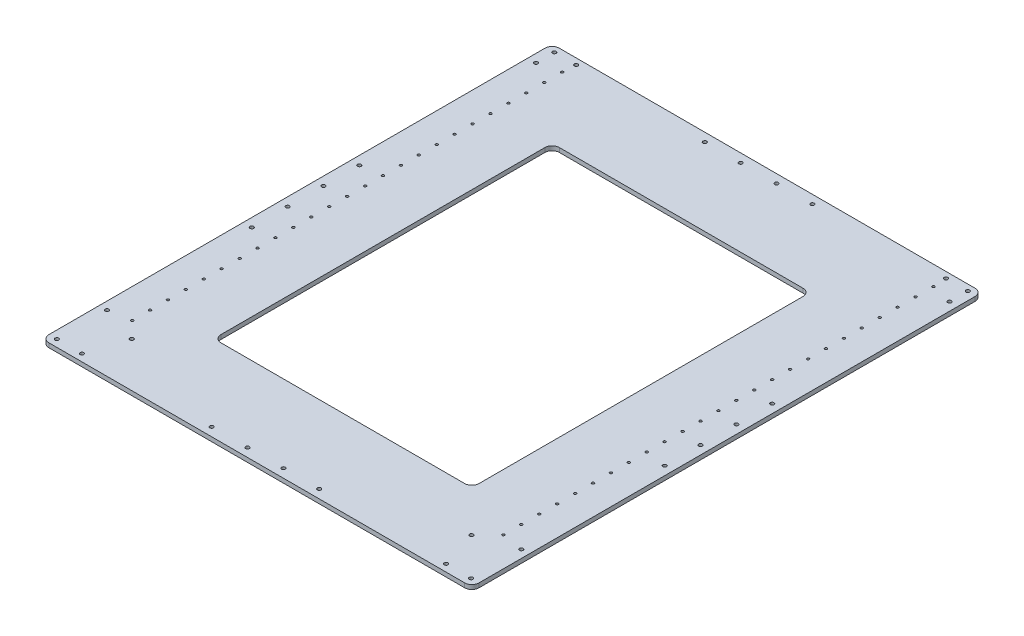
from build123d import *

# Parameters (mm, degrees)
SKETCH1_W                = 600
SKETCH1_H                = 730
BOSS_EXTRUDE1_DEPTH      = 6
SKETCH2_R                = 1.75
CUT_EXTRUDE1_DEPTH       = 473.505026428
LPATTERN1_COUNT          = 25
LPATTERN1_PITCH          = 25
MIRROR2_COPY_1_SKETCH_R  = 1.75
MIRROR2_COPY_1_DEPTH     = 473.505026428
MIRROR2_COPY_2_SKETCH_R  = 1.75
MIRROR2_COPY_2_DEPTH     = 473.505026428
MIRROR2_COPY_3_SKETCH_R  = 1.75
MIRROR2_COPY_3_DEPTH     = 473.505026428
MIRROR2_COPY_4_SKETCH_R  = 1.75
MIRROR2_COPY_4_DEPTH     = 473.505026428
MIRROR2_COPY_5_SKETCH_R  = 1.75
MIRROR2_COPY_5_DEPTH     = 473.505026428
MIRROR2_COPY_6_SKETCH_R  = 1.75
MIRROR2_COPY_6_DEPTH     = 473.505026428
MIRROR2_COPY_7_SKETCH_R  = 1.75
MIRROR2_COPY_7_DEPTH     = 473.505026428
MIRROR2_COPY_8_SKETCH_R  = 1.75
MIRROR2_COPY_8_DEPTH     = 473.505026428
MIRROR2_COPY_9_SKETCH_R  = 1.75
MIRROR2_COPY_9_DEPTH     = 473.505026428
MIRROR2_COPY_10_SKETCH_R = 1.75
MIRROR2_COPY_10_DEPTH    = 473.505026428
MIRROR2_COPY_11_SKETCH_R = 1.75
MIRROR2_COPY_11_DEPTH    = 473.505026428
MIRROR2_COPY_12_SKETCH_R = 1.75
MIRROR2_COPY_12_DEPTH    = 473.505026428
MIRROR2_COPY_13_SKETCH_R = 1.75
MIRROR2_COPY_13_DEPTH    = 473.505026428
MIRROR2_COPY_14_SKETCH_R = 1.75
MIRROR2_COPY_14_DEPTH    = 473.505026428
MIRROR2_COPY_15_SKETCH_R = 1.75
MIRROR2_COPY_15_DEPTH    = 473.505026428
MIRROR2_COPY_16_SKETCH_R = 1.75
MIRROR2_COPY_16_DEPTH    = 473.505026428
MIRROR2_COPY_17_SKETCH_R = 1.75
MIRROR2_COPY_17_DEPTH    = 473.505026428
MIRROR2_COPY_18_SKETCH_R = 1.75
MIRROR2_COPY_18_DEPTH    = 473.505026428
MIRROR2_COPY_19_SKETCH_R = 1.75
MIRROR2_COPY_19_DEPTH    = 473.505026428
MIRROR2_COPY_20_SKETCH_R = 1.75
MIRROR2_COPY_20_DEPTH    = 473.505026428
MIRROR2_COPY_21_SKETCH_R = 1.75
MIRROR2_COPY_21_DEPTH    = 473.505026428
MIRROR2_COPY_22_SKETCH_R = 1.75
MIRROR2_COPY_22_DEPTH    = 473.505026428
MIRROR2_COPY_23_SKETCH_R = 1.75
MIRROR2_COPY_23_DEPTH    = 473.505026428
MIRROR2_COPY_24_SKETCH_R = 1.75
MIRROR2_COPY_24_DEPTH    = 473.505026428
SKETCH3_R                = 2.55
CUT_EXTRUDE2_DEPTH       = 13
SKETCH5_R                = 2.55
CUT_EXTRUDE4_DEPTH       = 473.505026428
SKETCH6_W                = 600
SKETCH6_H                = 18
CUT_EXTRUDE5_DEPTH       = 6
CUT_EXTRUDE6_REACH       = 474.505
SKETCH7_R                = 2.55
CUT_EXTRUDE7_REACH       = 474.505
SKETCH8_R                = 2.55
CUT_EXTRUDE8_REACH       = 474.505
SKETCH9_W                = 360
SKETCH9_H                = 472
FILLET2_R                = 10


with BuildPart() as part:
    # Sketch1 → Boss-Extrude1 (new body)
    with BuildSketch(Plane(origin=(0, 0, 0), x_dir=(1, 0, 0), z_dir=(0, 1, 0))):
        Rectangle(SKETCH1_W, SKETCH1_H)
    extrude(amount=BOSS_EXTRUDE1_DEPTH)

    # Sketch2 → Cut-Extrude1 (cut, through all)
    with BuildSketch(Plane(origin=(0, 6, 0), x_dir=(1, 0, 0), z_dir=(0, 1, 0))):
        with Locations(Location((-259, 320, 0), (0, 0, 270))):
            Circle(SKETCH2_R)
    cut_extrude1 = extrude(amount=-CUT_EXTRUDE1_DEPTH, mode=Mode.SUBTRACT)

    # LPattern1: Cut-Extrude1 ×25
    with Locations(*[(0, 0, i * LPATTERN1_PITCH) for i in range(1, LPATTERN1_COUNT)]):
        add(cut_extrude1, mode=Mode.SUBTRACT)

    # Mirror2: Cut-Extrude1 across plane
    add(cut_extrude1.mirror(Plane(origin=(0, 0, 0), x_dir=(0, 0, 1), z_dir=(1, 0, 0))), mode=Mode.SUBTRACT)

    # Mirror2 copy 1 sketch → Mirror2 copy 1 (cut, through all)
    with BuildSketch(Plane(origin=(0, 6, 25), x_dir=(-1, 0, 0), z_dir=(0, 1, 0))):
        with Locations((-259, -320)):
            Circle(MIRROR2_COPY_1_SKETCH_R)
    extrude(amount=-MIRROR2_COPY_1_DEPTH, mode=Mode.SUBTRACT)

    # Mirror2 copy 2 sketch → Mirror2 copy 2 (cut, through all)
    with BuildSketch(Plane(origin=(0, 6, 50), x_dir=(-1, 0, 0), z_dir=(0, 1, 0))):
        with Locations((-259, -320)):
            Circle(MIRROR2_COPY_2_SKETCH_R)
    extrude(amount=-MIRROR2_COPY_2_DEPTH, mode=Mode.SUBTRACT)

    # Mirror2 copy 3 sketch → Mirror2 copy 3 (cut, through all)
    with BuildSketch(Plane(origin=(0, 6, 75), x_dir=(-1, 0, 0), z_dir=(0, 1, 0))):
        with Locations((-259, -320)):
            Circle(MIRROR2_COPY_3_SKETCH_R)
    extrude(amount=-MIRROR2_COPY_3_DEPTH, mode=Mode.SUBTRACT)

    # Mirror2 copy 4 sketch → Mirror2 copy 4 (cut, through all)
    with BuildSketch(Plane(origin=(0, 6, 100), x_dir=(-1, 0, 0), z_dir=(0, 1, 0))):
        with Locations((-259, -320)):
            Circle(MIRROR2_COPY_4_SKETCH_R)
    extrude(amount=-MIRROR2_COPY_4_DEPTH, mode=Mode.SUBTRACT)

    # Mirror2 copy 5 sketch → Mirror2 copy 5 (cut, through all)
    with BuildSketch(Plane(origin=(0, 6, 125), x_dir=(-1, 0, 0), z_dir=(0, 1, 0))):
        with Locations((-259, -320)):
            Circle(MIRROR2_COPY_5_SKETCH_R)
    extrude(amount=-MIRROR2_COPY_5_DEPTH, mode=Mode.SUBTRACT)

    # Mirror2 copy 6 sketch → Mirror2 copy 6 (cut, through all)
    with BuildSketch(Plane(origin=(0, 6, 150), x_dir=(-1, 0, 0), z_dir=(0, 1, 0))):
        with Locations((-259, -320)):
            Circle(MIRROR2_COPY_6_SKETCH_R)
    extrude(amount=-MIRROR2_COPY_6_DEPTH, mode=Mode.SUBTRACT)

    # Mirror2 copy 7 sketch → Mirror2 copy 7 (cut, through all)
    with BuildSketch(Plane(origin=(0, 6, 175), x_dir=(-1, 0, 0), z_dir=(0, 1, 0))):
        with Locations((-259, -320)):
            Circle(MIRROR2_COPY_7_SKETCH_R)
    extrude(amount=-MIRROR2_COPY_7_DEPTH, mode=Mode.SUBTRACT)

    # Mirror2 copy 8 sketch → Mirror2 copy 8 (cut, through all)
    with BuildSketch(Plane(origin=(0, 6, 200), x_dir=(-1, 0, 0), z_dir=(0, 1, 0))):
        with Locations((-259, -320)):
            Circle(MIRROR2_COPY_8_SKETCH_R)
    extrude(amount=-MIRROR2_COPY_8_DEPTH, mode=Mode.SUBTRACT)

    # Mirror2 copy 9 sketch → Mirror2 copy 9 (cut, through all)
    with BuildSketch(Plane(origin=(0, 6, 225), x_dir=(-1, 0, 0), z_dir=(0, 1, 0))):
        with Locations((-259, -320)):
            Circle(MIRROR2_COPY_9_SKETCH_R)
    extrude(amount=-MIRROR2_COPY_9_DEPTH, mode=Mode.SUBTRACT)

    # Mirror2 copy 10 sketch → Mirror2 copy 10 (cut, through all)
    with BuildSketch(Plane(origin=(0, 6, 250), x_dir=(-1, 0, 0), z_dir=(0, 1, 0))):
        with Locations((-259, -320)):
            Circle(MIRROR2_COPY_10_SKETCH_R)
    extrude(amount=-MIRROR2_COPY_10_DEPTH, mode=Mode.SUBTRACT)

    # Mirror2 copy 11 sketch → Mirror2 copy 11 (cut, through all)
    with BuildSketch(Plane(origin=(0, 6, 275), x_dir=(-1, 0, 0), z_dir=(0, 1, 0))):
        with Locations((-259, -320)):
            Circle(MIRROR2_COPY_11_SKETCH_R)
    extrude(amount=-MIRROR2_COPY_11_DEPTH, mode=Mode.SUBTRACT)

    # Mirror2 copy 12 sketch → Mirror2 copy 12 (cut, through all)
    with BuildSketch(Plane(origin=(0, 6, 300), x_dir=(-1, 0, 0), z_dir=(0, 1, 0))):
        with Locations((-259, -320)):
            Circle(MIRROR2_COPY_12_SKETCH_R)
    extrude(amount=-MIRROR2_COPY_12_DEPTH, mode=Mode.SUBTRACT)

    # Mirror2 copy 13 sketch → Mirror2 copy 13 (cut, through all)
    with BuildSketch(Plane(origin=(0, 6, 325), x_dir=(-1, 0, 0), z_dir=(0, 1, 0))):
        with Locations((-259, -320)):
            Circle(MIRROR2_COPY_13_SKETCH_R)
    extrude(amount=-MIRROR2_COPY_13_DEPTH, mode=Mode.SUBTRACT)

    # Mirror2 copy 14 sketch → Mirror2 copy 14 (cut, through all)
    with BuildSketch(Plane(origin=(0, 6, 350), x_dir=(-1, 0, 0), z_dir=(0, 1, 0))):
        with Locations((-259, -320)):
            Circle(MIRROR2_COPY_14_SKETCH_R)
    extrude(amount=-MIRROR2_COPY_14_DEPTH, mode=Mode.SUBTRACT)

    # Mirror2 copy 15 sketch → Mirror2 copy 15 (cut, through all)
    with BuildSketch(Plane(origin=(0, 6, 375), x_dir=(-1, 0, 0), z_dir=(0, 1, 0))):
        with Locations((-259, -320)):
            Circle(MIRROR2_COPY_15_SKETCH_R)
    extrude(amount=-MIRROR2_COPY_15_DEPTH, mode=Mode.SUBTRACT)

    # Mirror2 copy 16 sketch → Mirror2 copy 16 (cut, through all)
    with BuildSketch(Plane(origin=(0, 6, 400), x_dir=(-1, 0, 0), z_dir=(0, 1, 0))):
        with Locations((-259, -320)):
            Circle(MIRROR2_COPY_16_SKETCH_R)
    extrude(amount=-MIRROR2_COPY_16_DEPTH, mode=Mode.SUBTRACT)

    # Mirror2 copy 17 sketch → Mirror2 copy 17 (cut, through all)
    with BuildSketch(Plane(origin=(0, 6, 425), x_dir=(-1, 0, 0), z_dir=(0, 1, 0))):
        with Locations((-259, -320)):
            Circle(MIRROR2_COPY_17_SKETCH_R)
    extrude(amount=-MIRROR2_COPY_17_DEPTH, mode=Mode.SUBTRACT)

    # Mirror2 copy 18 sketch → Mirror2 copy 18 (cut, through all)
    with BuildSketch(Plane(origin=(0, 6, 450), x_dir=(-1, 0, 0), z_dir=(0, 1, 0))):
        with Locations((-259, -320)):
            Circle(MIRROR2_COPY_18_SKETCH_R)
    extrude(amount=-MIRROR2_COPY_18_DEPTH, mode=Mode.SUBTRACT)

    # Mirror2 copy 19 sketch → Mirror2 copy 19 (cut, through all)
    with BuildSketch(Plane(origin=(0, 6, 475), x_dir=(-1, 0, 0), z_dir=(0, 1, 0))):
        with Locations((-259, -320)):
            Circle(MIRROR2_COPY_19_SKETCH_R)
    extrude(amount=-MIRROR2_COPY_19_DEPTH, mode=Mode.SUBTRACT)

    # Mirror2 copy 20 sketch → Mirror2 copy 20 (cut, through all)
    with BuildSketch(Plane(origin=(0, 6, 500), x_dir=(-1, 0, 0), z_dir=(0, 1, 0))):
        with Locations((-259, -320)):
            Circle(MIRROR2_COPY_20_SKETCH_R)
    extrude(amount=-MIRROR2_COPY_20_DEPTH, mode=Mode.SUBTRACT)

    # Mirror2 copy 21 sketch → Mirror2 copy 21 (cut, through all)
    with BuildSketch(Plane(origin=(0, 6, 525), x_dir=(-1, 0, 0), z_dir=(0, 1, 0))):
        with Locations((-259, -320)):
            Circle(MIRROR2_COPY_21_SKETCH_R)
    extrude(amount=-MIRROR2_COPY_21_DEPTH, mode=Mode.SUBTRACT)

    # Mirror2 copy 22 sketch → Mirror2 copy 22 (cut, through all)
    with BuildSketch(Plane(origin=(0, 6, 550), x_dir=(-1, 0, 0), z_dir=(0, 1, 0))):
        with Locations((-259, -320)):
            Circle(MIRROR2_COPY_22_SKETCH_R)
    extrude(amount=-MIRROR2_COPY_22_DEPTH, mode=Mode.SUBTRACT)

    # Mirror2 copy 23 sketch → Mirror2 copy 23 (cut, through all)
    with BuildSketch(Plane(origin=(0, 6, 575), x_dir=(-1, 0, 0), z_dir=(0, 1, 0))):
        with Locations((-259, -320)):
            Circle(MIRROR2_COPY_23_SKETCH_R)
    extrude(amount=-MIRROR2_COPY_23_DEPTH, mode=Mode.SUBTRACT)

    # Mirror2 copy 24 sketch → Mirror2 copy 24 (cut, through all)
    with BuildSketch(Plane(origin=(0, 6, 600), x_dir=(-1, 0, 0), z_dir=(0, 1, 0))):
        with Locations((-259, -320)):
            Circle(MIRROR2_COPY_24_SKETCH_R)
    extrude(amount=-MIRROR2_COPY_24_DEPTH, mode=Mode.SUBTRACT)

    # Sketch3 → Cut-Extrude2 (cut)
    with BuildSketch(Plane(origin=(0, 6, 0), x_dir=(1, 0, 0), z_dir=(0, 1, 0))):
        with Locations(Location((-289, -285, 0), (0, 0, 270))):
            Circle(SKETCH3_R)
        with Locations(Location((-254, -355, 0), (0, 0, 270))):
            Circle(SKETCH3_R)
        with Locations(Location((-289, -355, 0), (0, 0, 270))):
            Circle(SKETCH3_R)
        with Locations(Location((-236.98, -302.5, 0), (0, 0, 270))):
            Circle(SKETCH3_R)
    cut_extrude2 = extrude(amount=-CUT_EXTRUDE2_DEPTH, mode=Mode.SUBTRACT)

    # Mirror3: Cut-Extrude2 across plane
    add(cut_extrude2.mirror(Plane(origin=(0, 0, 0), x_dir=(0, 0, 1), z_dir=(1, 0, 0))), mode=Mode.SUBTRACT)

    # Sketch5 → Cut-Extrude4 (cut, through all)
    with BuildSketch(Plane(origin=(0, 6, 0), x_dir=(1, 0, 0), z_dir=(0, 1, 0))):
        with Locations(Location((-288.48, 313, 0), (0, 0, 270))):
            Circle(SKETCH5_R)
        with Locations(Location((-257.98, 338.5, 0), (0, 0, 270))):
            Circle(SKETCH5_R)
        with Locations(Location((-288.48, 338.5, 0), (0, 0, 270))):
            Circle(SKETCH5_R)
    cut_extrude4 = extrude(amount=-CUT_EXTRUDE4_DEPTH, mode=Mode.SUBTRACT)

    # Mirror5: Cut-Extrude4 across plane
    add(cut_extrude4.mirror(Plane(origin=(0, 0, 0), x_dir=(0, 0, 1), z_dir=(1, 0, 0))), mode=Mode.SUBTRACT)

    # Sketch6 → Cut-Extrude5 (cut)
    with BuildSketch(Plane(origin=(0, 6, 0), x_dir=(1, 0, 0), z_dir=(0, 1, 0))):
        with Locations((0, 356)):
            Rectangle(SKETCH6_W, SKETCH6_H)
    extrude(amount=-CUT_EXTRUDE5_DEPTH, mode=Mode.SUBTRACT)

    # Sketch7 → Cut-Extrude6 (cut, up to next)
    with BuildSketch(Plane(origin=(0, 6, 0), x_dir=(1, 0, 0), z_dir=(0, 1, 0)), mode=Mode.PRIVATE) as cut_extrude6_sk1:
        with Locations(Location((-75, 335, 0), (0, 0, 270))):
            Circle(SKETCH7_R)
    cut_extrude6_tool1 = extrude(cut_extrude6_sk1.sketch, amount=-CUT_EXTRUDE6_REACH, mode=Mode.PRIVATE) & part.part
    # Sketch7 → Cut-Extrude6 (cut, up to next)
    with BuildSketch(Plane(origin=(0, 6, 0), x_dir=(1, 0, 0), z_dir=(0, 1, 0)), mode=Mode.PRIVATE) as cut_extrude6_sk2:
        with Locations(Location((-25, 335, 0), (0, 0, 270))):
            Circle(SKETCH7_R)
    cut_extrude6_tool2 = extrude(cut_extrude6_sk2.sketch, amount=-CUT_EXTRUDE6_REACH, mode=Mode.PRIVATE) & part.part
    # Sketch7 → Cut-Extrude6 (cut, up to next)
    with BuildSketch(Plane(origin=(0, 6, 0), x_dir=(1, 0, 0), z_dir=(0, 1, 0)), mode=Mode.PRIVATE) as cut_extrude6_sk3:
        with Locations(Location((25, 335, 0), (0, 0, 270))):
            Circle(SKETCH7_R)
    cut_extrude6_tool3 = extrude(cut_extrude6_sk3.sketch, amount=-CUT_EXTRUDE6_REACH, mode=Mode.PRIVATE) & part.part
    # Sketch7 → Cut-Extrude6 (cut, up to next)
    with BuildSketch(Plane(origin=(0, 6, 0), x_dir=(1, 0, 0), z_dir=(0, 1, 0)), mode=Mode.PRIVATE) as cut_extrude6_sk4:
        with Locations(Location((75, 335, 0), (0, 0, 270))):
            Circle(SKETCH7_R)
    cut_extrude6_tool4 = extrude(cut_extrude6_sk4.sketch, amount=-CUT_EXTRUDE6_REACH, mode=Mode.PRIVATE) & part.part
    # Sketch7 → Cut-Extrude6 (cut, up to next)
    with BuildSketch(Plane(origin=(0, 6, 0), x_dir=(1, 0, 0), z_dir=(0, 1, 0)), mode=Mode.PRIVATE) as cut_extrude6_sk5:
        with Locations(Location((75, -353, 0), (0, 0, 90))):
            Circle(SKETCH7_R)
    cut_extrude6_tool5 = extrude(cut_extrude6_sk5.sketch, amount=-CUT_EXTRUDE6_REACH, mode=Mode.PRIVATE) & part.part
    # Sketch7 → Cut-Extrude6 (cut, up to next)
    with BuildSketch(Plane(origin=(0, 6, 0), x_dir=(1, 0, 0), z_dir=(0, 1, 0)), mode=Mode.PRIVATE) as cut_extrude6_sk6:
        with Locations(Location((25, -353, 0), (0, 0, 90))):
            Circle(SKETCH7_R)
    cut_extrude6_tool6 = extrude(cut_extrude6_sk6.sketch, amount=-CUT_EXTRUDE6_REACH, mode=Mode.PRIVATE) & part.part
    # Sketch7 → Cut-Extrude6 (cut, up to next)
    with BuildSketch(Plane(origin=(0, 6, 0), x_dir=(1, 0, 0), z_dir=(0, 1, 0)), mode=Mode.PRIVATE) as cut_extrude6_sk7:
        with Locations(Location((-25, -353, 0), (0, 0, 90))):
            Circle(SKETCH7_R)
    cut_extrude6_tool7 = extrude(cut_extrude6_sk7.sketch, amount=-CUT_EXTRUDE6_REACH, mode=Mode.PRIVATE) & part.part
    # Sketch7 → Cut-Extrude6 (cut, up to next)
    with BuildSketch(Plane(origin=(0, 6, 0), x_dir=(1, 0, 0), z_dir=(0, 1, 0)), mode=Mode.PRIVATE) as cut_extrude6_sk8:
        with Locations(Location((-75, -353, 0), (0, 0, 90))):
            Circle(SKETCH7_R)
    cut_extrude6_tool8 = extrude(cut_extrude6_sk8.sketch, amount=-CUT_EXTRUDE6_REACH, mode=Mode.PRIVATE) & part.part
    add(cut_extrude6_tool1.solids().sort_by_distance((-75, 6, -335))[0], mode=Mode.SUBTRACT)
    add(cut_extrude6_tool2.solids().sort_by_distance((-25, 6, -335))[0], mode=Mode.SUBTRACT)
    add(cut_extrude6_tool3.solids().sort_by_distance((25, 6, -335))[0], mode=Mode.SUBTRACT)
    add(cut_extrude6_tool4.solids().sort_by_distance((75, 6, -335))[0], mode=Mode.SUBTRACT)
    add(cut_extrude6_tool5.solids().sort_by_distance((75, 6, 353))[0], mode=Mode.SUBTRACT)
    add(cut_extrude6_tool6.solids().sort_by_distance((25, 6, 353))[0], mode=Mode.SUBTRACT)
    add(cut_extrude6_tool7.solids().sort_by_distance((-25, 6, 353))[0], mode=Mode.SUBTRACT)
    add(cut_extrude6_tool8.solids().sort_by_distance((-75, 6, 353))[0], mode=Mode.SUBTRACT)

    # Sketch8 → Cut-Extrude7 (cut, up to next)
    with BuildSketch(Plane(origin=(0, 6, 0), x_dir=(1, 0, 0), z_dir=(0, 1, 0)), mode=Mode.PRIVATE) as cut_extrude7_sk1:
        with Locations(Location((288, 66, 0), (0, 0, 270))):
            Circle(SKETCH8_R)
    cut_extrude7_tool1 = extrude(cut_extrude7_sk1.sketch, amount=-CUT_EXTRUDE7_REACH, mode=Mode.PRIVATE) & part.part
    # Sketch8 → Cut-Extrude7 (cut, up to next)
    with BuildSketch(Plane(origin=(0, 6, 0), x_dir=(1, 0, 0), z_dir=(0, 1, 0)), mode=Mode.PRIVATE) as cut_extrude7_sk2:
        with Locations(Location((288, 16, 0), (0, 0, 270))):
            Circle(SKETCH8_R)
    cut_extrude7_tool2 = extrude(cut_extrude7_sk2.sketch, amount=-CUT_EXTRUDE7_REACH, mode=Mode.PRIVATE) & part.part
    # Sketch8 → Cut-Extrude7 (cut, up to next)
    with BuildSketch(Plane(origin=(0, 6, 0), x_dir=(1, 0, 0), z_dir=(0, 1, 0)), mode=Mode.PRIVATE) as cut_extrude7_sk3:
        with Locations(Location((288, -34, 0), (0, 0, 270))):
            Circle(SKETCH8_R)
    cut_extrude7_tool3 = extrude(cut_extrude7_sk3.sketch, amount=-CUT_EXTRUDE7_REACH, mode=Mode.PRIVATE) & part.part
    # Sketch8 → Cut-Extrude7 (cut, up to next)
    with BuildSketch(Plane(origin=(0, 6, 0), x_dir=(1, 0, 0), z_dir=(0, 1, 0)), mode=Mode.PRIVATE) as cut_extrude7_sk4:
        with Locations(Location((288, -84, 0), (0, 0, 270))):
            Circle(SKETCH8_R)
    cut_extrude7_tool4 = extrude(cut_extrude7_sk4.sketch, amount=-CUT_EXTRUDE7_REACH, mode=Mode.PRIVATE) & part.part
    cut_extrude7_1 = cut_extrude7_tool1.solids().sort_by_distance((288, 6, -66))[0]
    add(cut_extrude7_1, mode=Mode.SUBTRACT)
    cut_extrude7_2 = cut_extrude7_tool2.solids().sort_by_distance((288, 6, -16))[0]
    add(cut_extrude7_2, mode=Mode.SUBTRACT)
    cut_extrude7_3 = cut_extrude7_tool3.solids().sort_by_distance((288, 6, 34))[0]
    add(cut_extrude7_3, mode=Mode.SUBTRACT)
    cut_extrude7_4 = cut_extrude7_tool4.solids().sort_by_distance((288, 6, 84))[0]
    add(cut_extrude7_4, mode=Mode.SUBTRACT)
    cut_extrude7 = cut_extrude7_1 + cut_extrude7_2 + cut_extrude7_3 + cut_extrude7_4  # Cut-Extrude7 as one shape, for the pattern or mirror that repeats it

    # Mirror6: Cut-Extrude7 across plane
    add(cut_extrude7.mirror(Plane(origin=(0, 0, 0), x_dir=(0, 0, 1), z_dir=(1, 0, 0))), mode=Mode.SUBTRACT)

    # Sketch9 → Cut-Extrude8 (cut, up to next)
    with BuildSketch(Plane(origin=(0, 6, 0), x_dir=(1, 0, 0), z_dir=(0, 1, 0)), mode=Mode.PRIVATE) as cut_extrude8_sk1:
        with Locations((0, -9)):
            Rectangle(SKETCH9_W, SKETCH9_H)
    cut_extrude8_tool1 = extrude(cut_extrude8_sk1.sketch, amount=-CUT_EXTRUDE8_REACH, mode=Mode.PRIVATE) & part.part
    add(cut_extrude8_tool1.solids().sort_by_distance((0, 6, 9))[0], mode=Mode.SUBTRACT)

    # Fillet2
    fillet2_edges = [part.edges().sort_by_distance(p)[0] for p in [
        (-300, 3, -347),
        (300, 3, -347),
        (180, 3, -227),
        (180, 3, 245),
        (-180, 3, 245),
        (-180, 3, -227),
        (300, 3, 365),
        (-300, 3, 365),
    ]]
    fillet(fillet2_edges, radius=FILLET2_R)


solid = part.part
